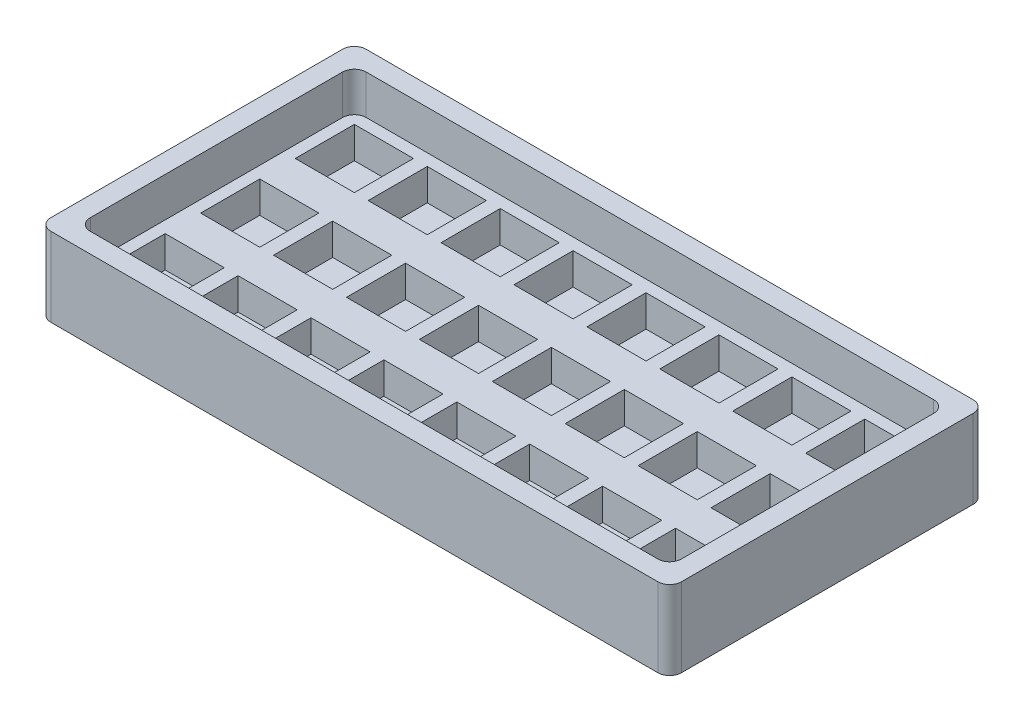
from build123d import *

# Parameters (mm, degrees)
SKETCH1_W           = 15
SKETCH1_H           = 15
BOSS_EXTRUDE1_DEPTH = 8
BOSS_EXTRUDE2_DEPTH = 18
BOSS_EXTRUDE3_START = -2
BOSS_EXTRUDE3_DEPTH = 2


with BuildPart() as part:
    # Sketch1 → Boss-Extrude1 (new body)
    with BuildSketch(Plane(origin=(0, 0, 0), x_dir=(1, 0, 0), z_dir=(0, 1, 0))):
        with BuildLine():
            Line((77, 40), (-77, 40))
            ThreePointArc((-77, 40), (-79.121320344, 39.121320344), (-80, 37))
            Line((-80, 37), (-80, -37))
            ThreePointArc((-80, -37), (-79.121320344, -39.121320344), (-77, -40))
            Line((-77, -40), (77, -40))
            ThreePointArc((77, -40), (79.121320344, -39.121320344), (80, -37))
            Line((80, -37), (80, 37))
            ThreePointArc((80, 37), (79.121320344, 39.121320344), (77, 40))
        make_face()
        with Locations((-64.5, -23.5)):
            Rectangle(SKETCH1_W, SKETCH1_H, mode=Mode.SUBTRACT)
        with Locations((-46, -23.5)):
            Rectangle(SKETCH1_W, SKETCH1_H, mode=Mode.SUBTRACT)
        with Locations((-27.5, -23.5)):
            Rectangle(SKETCH1_W, SKETCH1_H, mode=Mode.SUBTRACT)
        with Locations((-9, -23.5)):
            Rectangle(SKETCH1_W, SKETCH1_H, mode=Mode.SUBTRACT)
        with Locations((9.5, -23.5)):
            Rectangle(SKETCH1_W, SKETCH1_H, mode=Mode.SUBTRACT)
        with Locations((28, -23.5)):
            Rectangle(SKETCH1_W, SKETCH1_H, mode=Mode.SUBTRACT)
        with Locations((46.5, -23.5)):
            Rectangle(SKETCH1_W, SKETCH1_H, mode=Mode.SUBTRACT)
        with Locations((65, -23.5)):
            Rectangle(SKETCH1_W, SKETCH1_H, mode=Mode.SUBTRACT)
        with Locations((-64.5, 0.5)):
            Rectangle(SKETCH1_W, SKETCH1_H, mode=Mode.SUBTRACT)
        with Locations((-46, 0.5)):
            Rectangle(SKETCH1_W, SKETCH1_H, mode=Mode.SUBTRACT)
        with Locations((-27.5, 0.5)):
            Rectangle(SKETCH1_W, SKETCH1_H, mode=Mode.SUBTRACT)
        with Locations((-9, 0.5)):
            Rectangle(SKETCH1_W, SKETCH1_H, mode=Mode.SUBTRACT)
        with Locations((-64.5, 24.5)):
            Rectangle(SKETCH1_W, SKETCH1_H, mode=Mode.SUBTRACT)
        with Locations((-46, 24.5)):
            Rectangle(SKETCH1_W, SKETCH1_H, mode=Mode.SUBTRACT)
        with Locations((-27.5, 24.5)):
            Rectangle(SKETCH1_W, SKETCH1_H, mode=Mode.SUBTRACT)
        with Locations((-9, 24.5)):
            Rectangle(SKETCH1_W, SKETCH1_H, mode=Mode.SUBTRACT)
        with Locations((9.5, 0.5)):
            Rectangle(SKETCH1_W, SKETCH1_H, mode=Mode.SUBTRACT)
        with Locations((28, 0.5)):
            Rectangle(SKETCH1_W, SKETCH1_H, mode=Mode.SUBTRACT)
        with Locations((46.5, 0.5)):
            Rectangle(SKETCH1_W, SKETCH1_H, mode=Mode.SUBTRACT)
        with Locations((65, 0.5)):
            Rectangle(SKETCH1_W, SKETCH1_H, mode=Mode.SUBTRACT)
        with Locations((9.5, 24.5)):
            Rectangle(SKETCH1_W, SKETCH1_H, mode=Mode.SUBTRACT)
        with Locations((28, 24.5)):
            Rectangle(SKETCH1_W, SKETCH1_H, mode=Mode.SUBTRACT)
        with Locations((46.5, 24.5)):
            Rectangle(SKETCH1_W, SKETCH1_H, mode=Mode.SUBTRACT)
        with Locations((65, 24.5)):
            Rectangle(SKETCH1_W, SKETCH1_H, mode=Mode.SUBTRACT)
    extrude(amount=BOSS_EXTRUDE1_DEPTH)

    # Sketch1<3> → Boss-Extrude2 (add)
    with BuildSketch(Plane(origin=(0, 0, 0), x_dir=(1, 0, 0), z_dir=(0, 1, 0))):
        with BuildLine():
            Line((-77, 40), (77, 40))
            ThreePointArc((77, 40), (79.121320344, 39.121320344), (80, 37))
            Line((80, 37), (80, -37))
            ThreePointArc((80, -37), (79.121320344, -39.121320344), (77, -40))
            Line((77, -40), (-77, -40))
            ThreePointArc((-77, -40), (-79.121320344, -39.121320344), (-80, -37))
            Line((-80, -37), (-80, 37))
            ThreePointArc((-80, 37), (-79.121320344, 39.121320344), (-77, 40))
        make_face()
        with BuildLine():
            Line((-72, 35), (72, 35))
            ThreePointArc((72, 35), (74.121320344, 34.121320344), (75, 32))
            Line((75, 32), (75, -32))
            ThreePointArc((75, -32), (74.121320344, -34.121320344), (72, -35))
            Line((72, -35), (-72, -35))
            ThreePointArc((-72, -35), (-74.121320344, -34.121320344), (-75, -32))
            Line((-75, -32), (-75, 32))
            ThreePointArc((-75, 32), (-74.121320344, 34.121320344), (-72, 35))
        make_face(mode=Mode.SUBTRACT)
    extrude(amount=BOSS_EXTRUDE2_DEPTH)

    # Sketch1<4> → Boss-Extrude3 (add)
    with BuildSketch(Plane(origin=(0, 0, 0), x_dir=(1, 0, 0), z_dir=(0, 1, 0)).offset(BOSS_EXTRUDE3_START)):
        with BuildLine():
            Line((-77, 40), (77, 40))
            ThreePointArc((77, 40), (79.121320344, 39.121320344), (80, 37))
            Line((80, 37), (80, -37))
            ThreePointArc((80, -37), (79.121320344, -39.121320344), (77, -40))
            Line((77, -40), (-77, -40))
            ThreePointArc((-77, -40), (-79.121320344, -39.121320344), (-80, -37))
            Line((-80, -37), (-80, 37))
            ThreePointArc((-80, 37), (-79.121320344, 39.121320344), (-77, 40))
        make_face()
    extrude(amount=BOSS_EXTRUDE3_DEPTH)


solid = part.part
